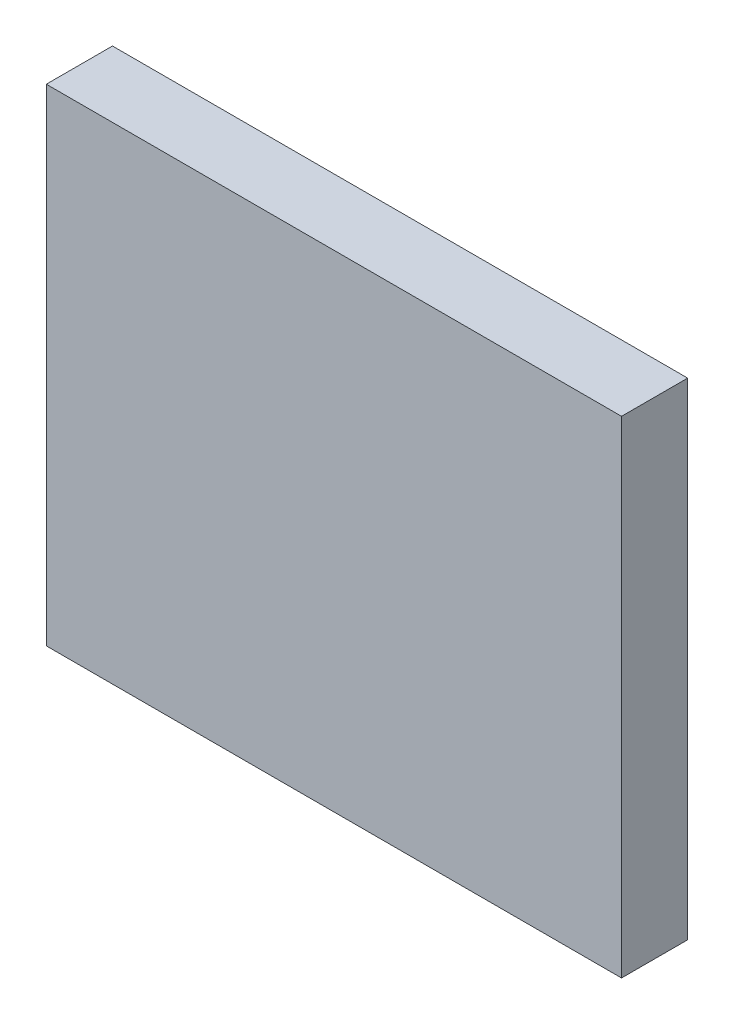
from build123d import *

# Parameters (mm, degrees)
SKETCH1_W           = 8.6943
SKETCH1_H           = 7.3525
BOSS_EXTRUDE1_DEPTH = 1


with BuildPart() as part:
    # Sketch1 → Boss-Extrude1 (new body)
    with BuildSketch(Plane.XY):
        with Locations((0, 0.07375)):
            Rectangle(SKETCH1_W, SKETCH1_H)
    extrude(amount=BOSS_EXTRUDE1_DEPTH)


solid = part.part
